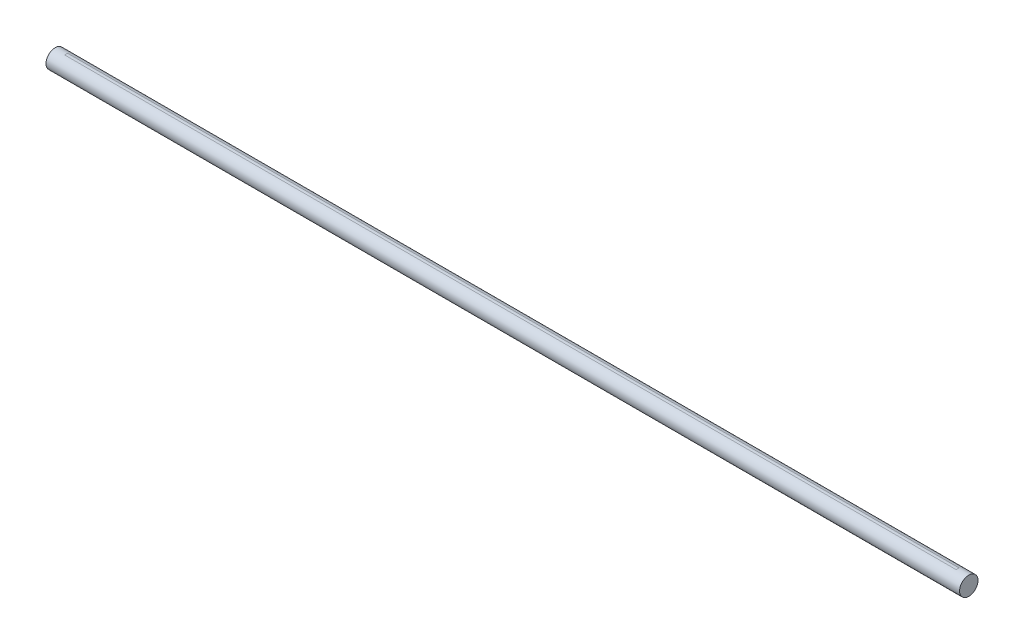
from build123d import *

# Parameters (mm, degrees)
SKETCH1_R           = 15.875
BOSS_EXTRUDE1_DEPTH = 1574.8


with BuildPart() as part:
    # Sketch1 → Boss-Extrude1 (new body)
    with BuildSketch(Plane(origin=(0, 0, 0), x_dir=(0, 0, -1), z_dir=(1, 0, 0))):
        Circle(SKETCH1_R)
    extrude(amount=-BOSS_EXTRUDE1_DEPTH)


solid = part.part
